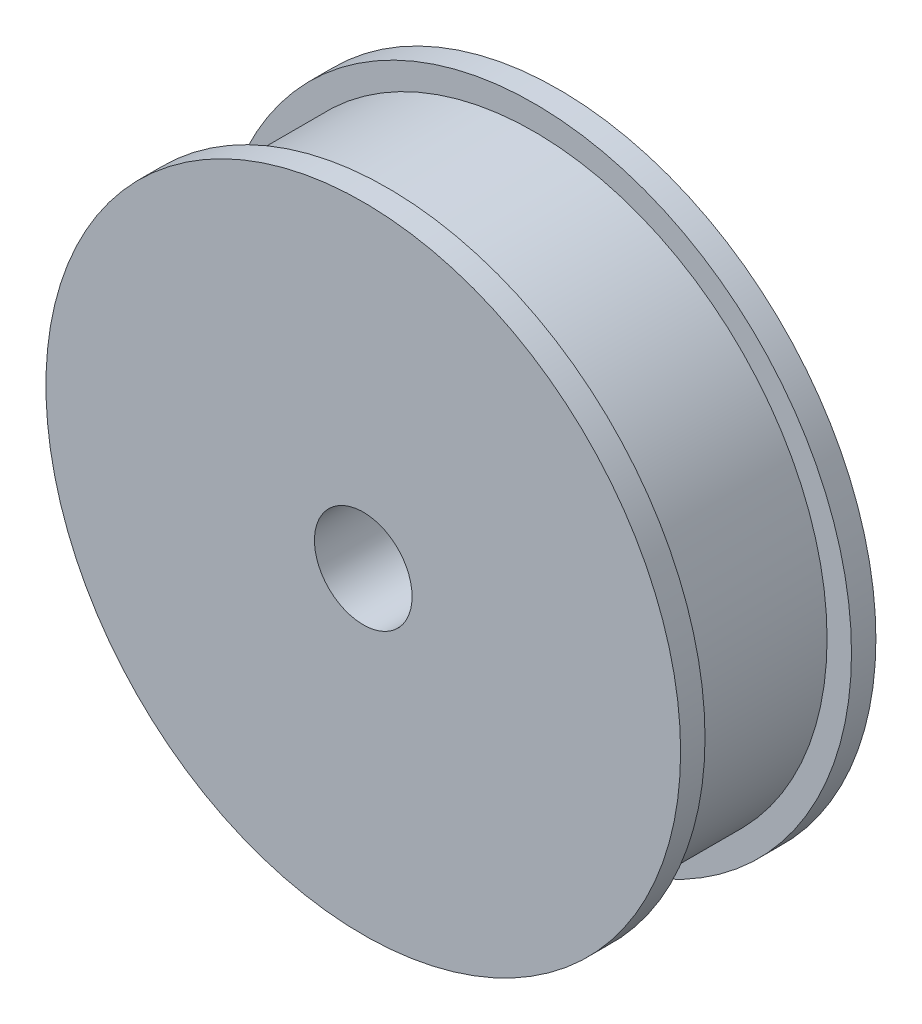
from build123d import *

# Parameters (mm, degrees)
SKETCH_1_R               = 19.5
EXTRUDE_1_DEPTH          = 12
CUT_EXTRUDE_1_DEPTH      = 4.5
CUT_EXTRUDE_1_DEPTH_BACK = 4.5
SKETCH_2_R               = 19.5
SKETCH_2_R_2             = 18
SKETCH_3_R               = 3
CUT_EXTRUDE_2_DEPTH      = 31.074906484


with BuildPart() as part:
    # 草图1 → 凸台-拉伸1 (new body)
    with BuildSketch(Plane.XY):
        Circle(SKETCH_1_R)
    extrude(amount=EXTRUDE_1_DEPTH)

    # 草图2 → 切除-拉伸1 (cut, two sides: drawn at the far end of the back side and taken through both)
    with BuildSketch(Plane.XY.offset(6).offset(-CUT_EXTRUDE_1_DEPTH_BACK)):
        Circle(SKETCH_2_R)
        Circle(SKETCH_2_R_2, mode=Mode.SUBTRACT)
    extrude(amount=CUT_EXTRUDE_1_DEPTH + CUT_EXTRUDE_1_DEPTH_BACK, mode=Mode.SUBTRACT)

    # 草图3 → 切除-拉伸2 (cut, through all)
    with BuildSketch(Plane.XY.offset(12)):
        Circle(SKETCH_3_R)
    extrude(amount=-CUT_EXTRUDE_2_DEPTH, mode=Mode.SUBTRACT)


solid = part.part
